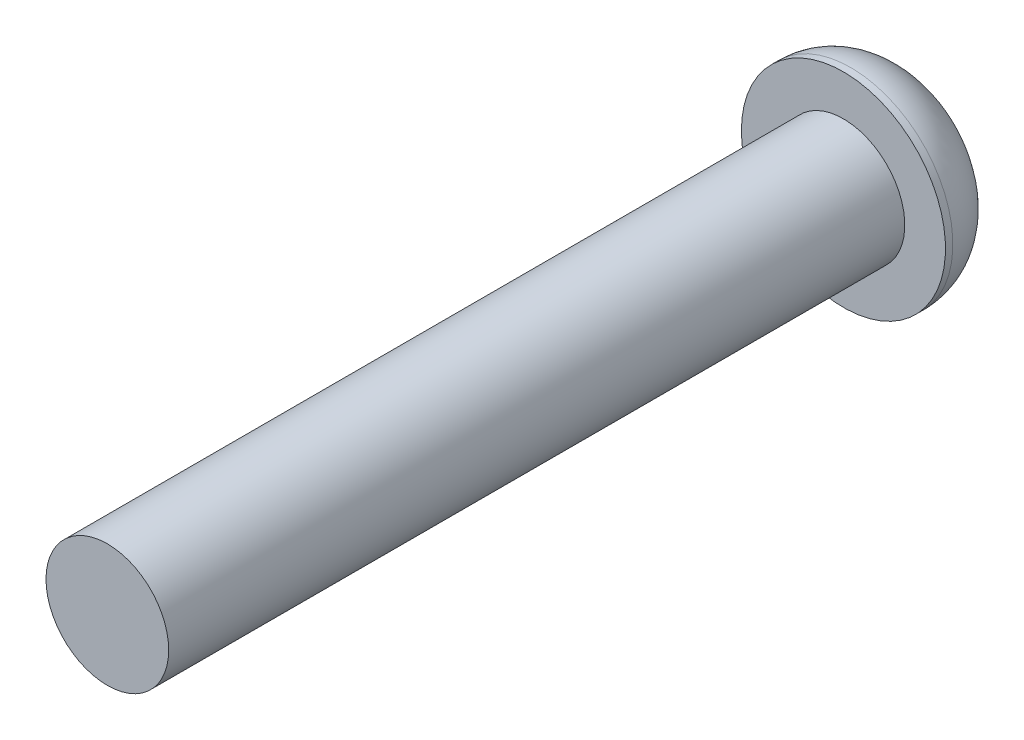
from build123d import *

# Parameters (mm, degrees)
SKETCH1_R           = 2.5
BOSS_EXTRUDE1_DEPTH = 30
SKETCH2_R           = 4.159584877
BOSS_EXTRUDE2_DEPTH = 2.8
FILLET1_R           = 2.5
CUT_EXTRUDE1_DEPTH  = 2


with BuildPart() as part:
    # Sketch1 → Boss-Extrude1 (new body)
    with BuildSketch(Plane.XY):
        Circle(SKETCH1_R)
    extrude(amount=BOSS_EXTRUDE1_DEPTH)

    # Sketch2 → Boss-Extrude2 (add)
    with BuildSketch(Plane(origin=(0, 0, 0), x_dir=(-1, 0, 0), z_dir=(0, 0, -1))):
        Circle(SKETCH2_R)
    extrude(amount=BOSS_EXTRUDE2_DEPTH)

    # Fillet1
    fillet1_edges = [part.edges().sort_by_distance(p)[0] for p in [
        (4.159584877, 0, -2.8),
    ]]
    fillet(fillet1_edges, radius=FILLET1_R)

    # Sketch3 → Cut-Extrude1 (cut)
    with BuildSketch(Plane(origin=(0, 0, -2.8), x_dir=(-1, 0, 0), z_dir=(0, 0, -1))):
        Polygon((1.392434699, -0.636521364), (1.247461021, 0.88762314), (-0.144973678, 1.524144504), (-1.392434699, 0.636521364), (-1.247461021, -0.88762314), (0.144973678, -1.524144504), align=None)
    extrude(amount=-CUT_EXTRUDE1_DEPTH, mode=Mode.SUBTRACT)


solid = part.part
